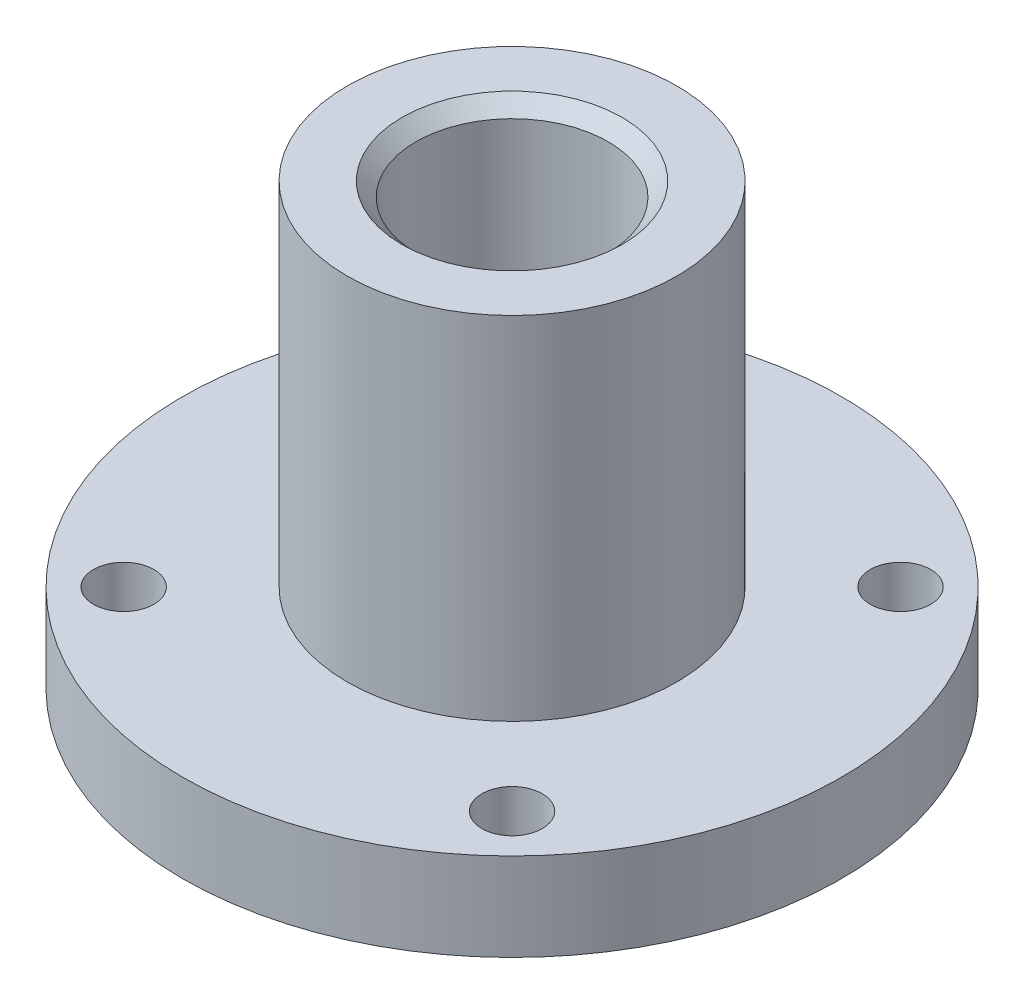
from build123d import *

# Parameters (mm, degrees)
HOLE_WIZARD_M201_D           = 17.5
HOLE_WIZARD_M201_CSINK_D     = 20.05
HOLE_WIZARD_M201_CSINK_ANGLE = 90
SKETCH_4_R                   = 2.75
CUT_EXTRUDE_1_DEPTH          = 54.141321022


with BuildPart() as part:
    # Эскиз1 → Повернуть1 (revolve)
    with BuildSketch(Plane.XY):
        Polygon((0, 0), (-30, 0), (-30, 8), (-15, 8), (-15, 40), (0, 40), align=None)
    revolve(axis=Axis((0, 20.983482592, 0), (0, -1, 0)))

    # Отверстие обработанное метчиком M201 (through all)
    with Locations(Plane(origin=(0, 40, 0), x_dir=(1, 0, 0), z_dir=(0, 1, 0))):
        with Locations((0, 0)):
            CounterSinkHole(HOLE_WIZARD_M201_D / 2, HOLE_WIZARD_M201_CSINK_D / 2, counter_sink_angle=HOLE_WIZARD_M201_CSINK_ANGLE)

    # Эскиз4 → Вырез-Вытянуть1 (cut, through all)
    with BuildSketch(Plane(origin=(0, 8, 0), x_dir=(1, 0, 0), z_dir=(0, 1, 0))):
        with Locations((-17.67766953, 17.67766953)):
            Circle(SKETCH_4_R)
        with Locations((-17.67766953, -17.67766953)):
            Circle(SKETCH_4_R)
        with Locations((17.67766953, 17.67766953)):
            Circle(SKETCH_4_R)
        with Locations((17.67766953, -17.67766953)):
            Circle(SKETCH_4_R)
    extrude(amount=-CUT_EXTRUDE_1_DEPTH, mode=Mode.SUBTRACT)


solid = part.part
